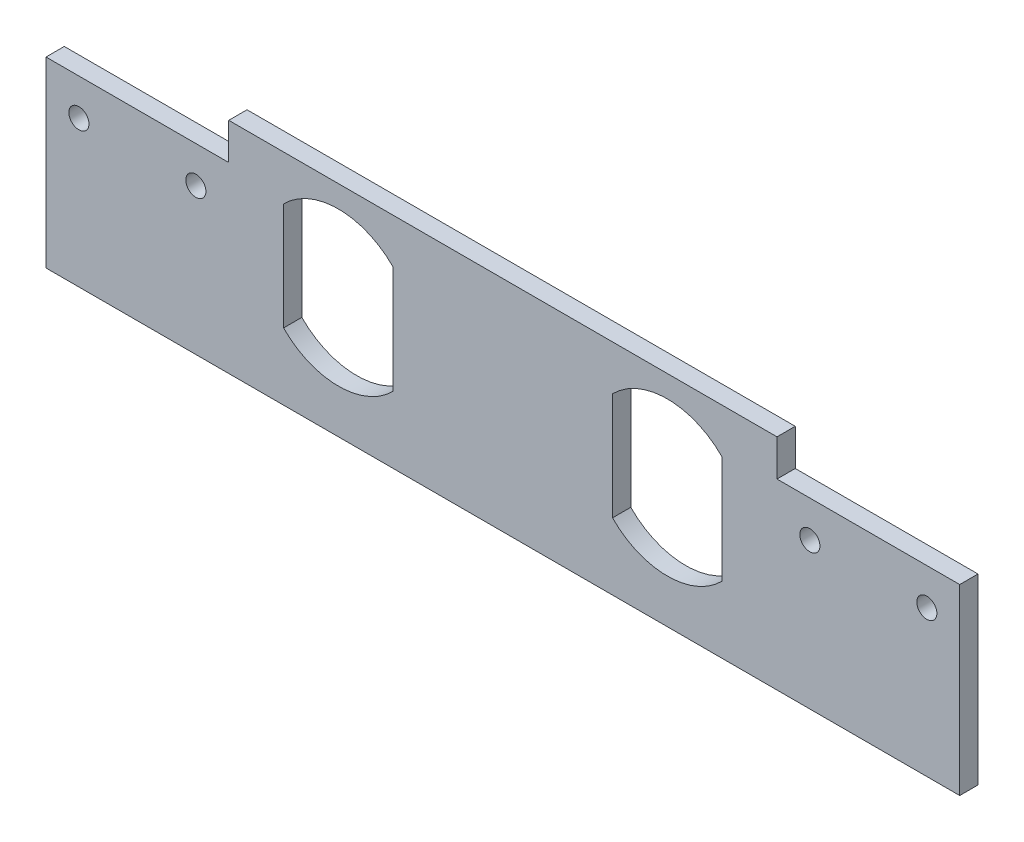
from build123d import *

# Parameters (mm, degrees)
SKETCH_1_W          = 290
SKETCH_1_H          = 50
EXTRUDE_1_DEPTH     = 5
SKETCH_3_W          = 20
SKETCH_3_H          = 50
CUT_EXTRUDE_1_DEPTH = 10
SKETCH_4_W          = 150
SKETCH_4_H          = 5
EXTRUDE_2_DEPTH     = 10
SKETCH_5_R          = 2.75
CUT_EXTRUDE_4_DEPTH = 130.903810568
CUT_EXTRUDE_5_DEPTH = 10


with BuildPart() as part:
    # 스케치1 → 보스-돌출1 (new body)
    with BuildSketch(Plane.XY):
        Rectangle(SKETCH_1_W, SKETCH_1_H)
    extrude(amount=EXTRUDE_1_DEPTH)

    # 스케치3 → 컷-돌출1 (cut)
    with BuildSketch(Plane.XY.offset(5)):
        with Locations((-135, 0)):
            Rectangle(SKETCH_3_W, SKETCH_3_H)
    cut_extrude_1 = extrude(amount=-CUT_EXTRUDE_1_DEPTH, mode=Mode.SUBTRACT)

    # 대칭 복사1: 컷-돌출1 across plane
    add(cut_extrude_1.mirror(Plane(origin=(0, 0, 0), x_dir=(0, 0, 1), z_dir=(1, 0, 0))), mode=Mode.SUBTRACT)

    # 스케치4 → 보스-돌출2 (add)
    with BuildSketch(Plane(origin=(0, 25, 0), x_dir=(1, 0, 0), z_dir=(0, 1, 0))):
        with Locations((0, -2.5)):
            Rectangle(SKETCH_4_W, SKETCH_4_H)
    extrude(amount=EXTRUDE_2_DEPTH)

    # 스케치5 → 컷-돌출4 (cut, through all)
    with BuildSketch(Plane.XY.offset(5)):
        with Locations((-84, 15)):
            Circle(SKETCH_5_R)
        with Locations((-116, 15)):
            Circle(SKETCH_5_R)
        with Locations(Location((116, 15, 0), (0, 0, 180))):
            Circle(SKETCH_5_R)
        with Locations(Location((84, 15, 0), (0, 0, 180))):
            Circle(SKETCH_5_R)
    extrude(amount=-CUT_EXTRUDE_4_DEPTH, mode=Mode.SUBTRACT)

    # 스케치6 → 컷-돌출5 (cut)
    with BuildSketch(Plane.XY.offset(5)):
        with BuildLine():
            Line((59.99900565, 22.696938457), (59.99900565, -6.696938457))
            ThreePointArc((59.99900565, -6.696938457), (44.99900565, -13), (29.99900565, -6.696938457))
            Line((29.99900565, -6.696938457), (29.99900565, 22.696938457))
            ThreePointArc((29.99900565, 22.696938457), (44.99900565, 29), (59.99900565, 22.696938457))
        make_face()
    cut_extrude_5 = extrude(amount=-CUT_EXTRUDE_5_DEPTH, mode=Mode.SUBTRACT)

    # 대칭 복사2: 컷-돌출5 across plane
    add(cut_extrude_5.mirror(Plane.ZY), mode=Mode.SUBTRACT)


solid = part.part
